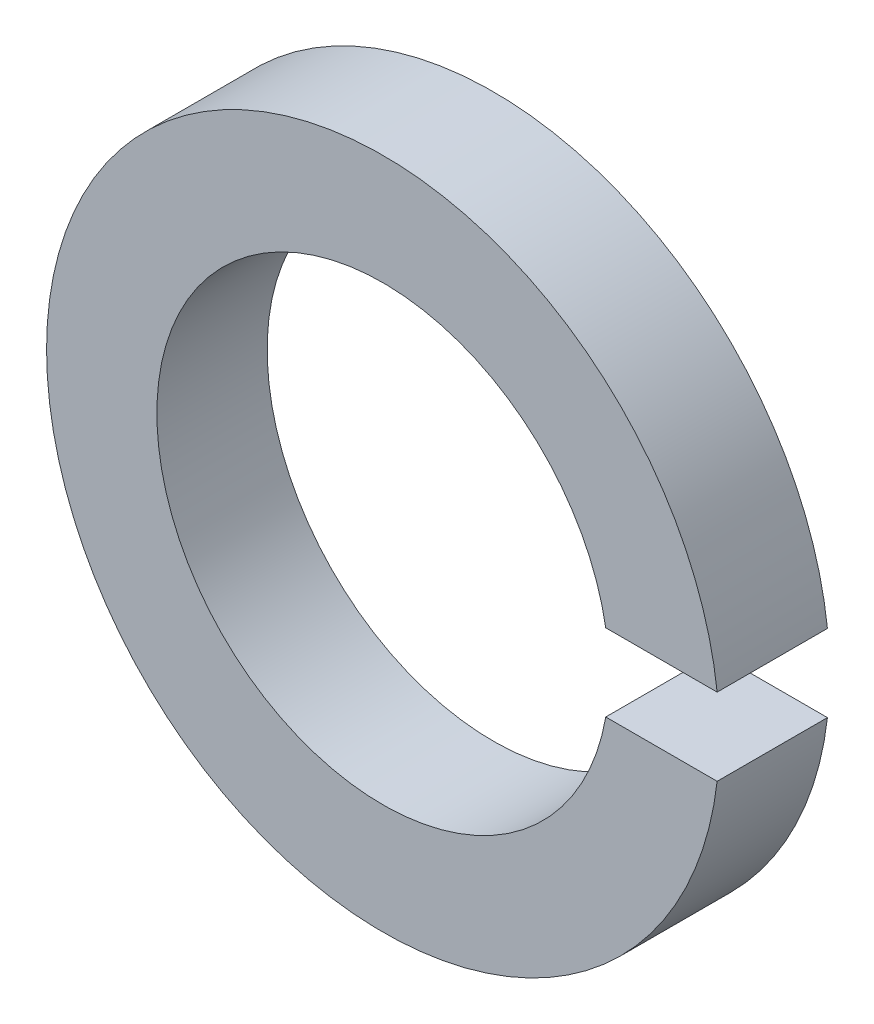
from build123d import *

# Parameters (mm, degrees)
SKETCH_1_R          = 3.05
SKETCH_1_R_2        = 2.05
EXTRUDE_1_DEPTH     = 1
SKETCH_2_W          = 1.111960385
SKETCH_2_H          = 0.7
CUT_EXTRUDE_1_DEPTH = 5.427753381


with BuildPart() as part:
    # Эскиз1 → Вытянуть1 (new body)
    with BuildSketch(Plane.XY):
        Circle(SKETCH_1_R)
        Circle(SKETCH_1_R_2, mode=Mode.SUBTRACT)
    extrude(amount=EXTRUDE_1_DEPTH)

    # Эскиз2 → Вырез-Вытянуть1 (cut, through all)
    with BuildSketch(Plane.XY.offset(1)):
        with Locations((2.553185263, 0)):
            Rectangle(SKETCH_2_W, SKETCH_2_H)
    extrude(amount=-CUT_EXTRUDE_1_DEPTH, mode=Mode.SUBTRACT)


solid = part.part
